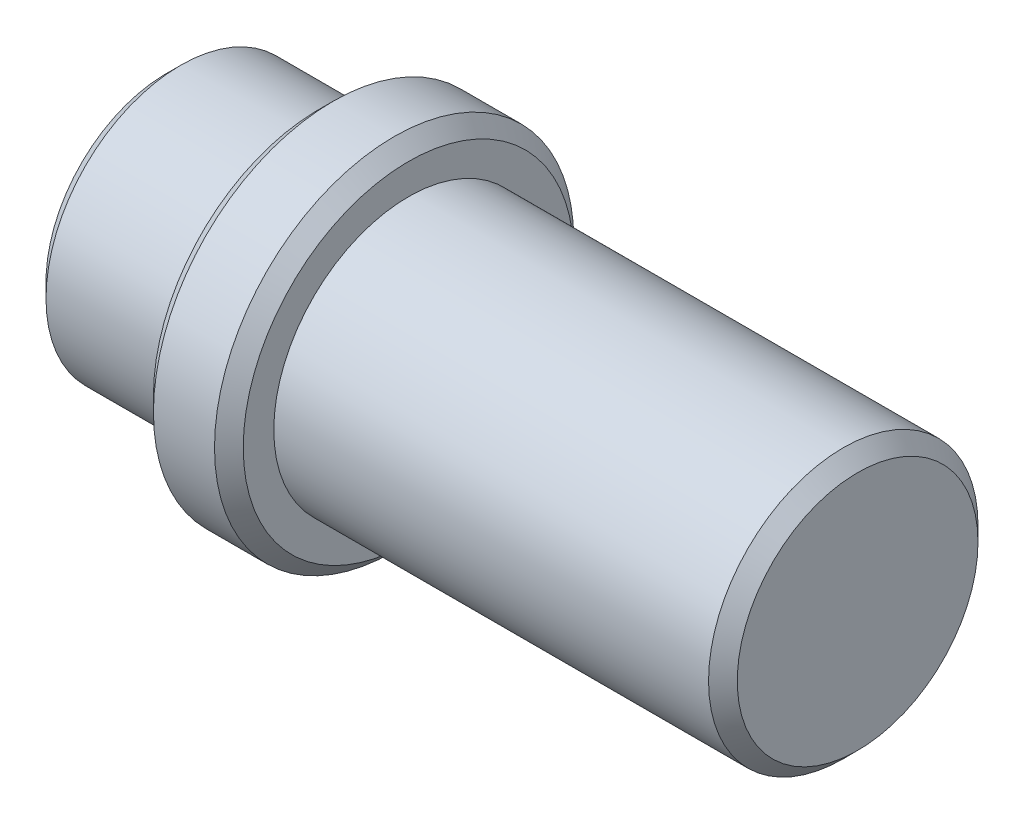
from build123d import *

# Parameters (mm, degrees)
SKETCH1_R           = 2.38125
BOSS_EXTRUDE1_DEPTH = 12.2174
SKETCH2_R           = 3.175
BOSS_EXTRUDE2_DEPTH = 1.5875
CHAMFER1_SIZE       = 0.254


with BuildPart() as part:
    # Sketch1 → Boss-Extrude1 (new body)
    with BuildSketch(Plane(origin=(0, 0, 0), x_dir=(0, 0, -1), z_dir=(1, 0, 0))):
        Circle(SKETCH1_R)
    extrude(amount=BOSS_EXTRUDE1_DEPTH)

    # Sketch2 → Boss-Extrude2 (add)
    with BuildSketch(Plane.ZY.offset(-2.6924)):
        Circle(SKETCH2_R)
    extrude(amount=-BOSS_EXTRUDE2_DEPTH)

    # Chamfer1
    chamfer1_edges = [part.edges().sort_by_distance(p)[0] for p in [
        (0, 0, 2.38125),
        (12.2174, 0, 2.38125),
        (2.6924, 0, -3.175),
        (4.2799, 0, -3.175),
    ]]
    chamfer(chamfer1_edges, length=CHAMFER1_SIZE)


solid = part.part
